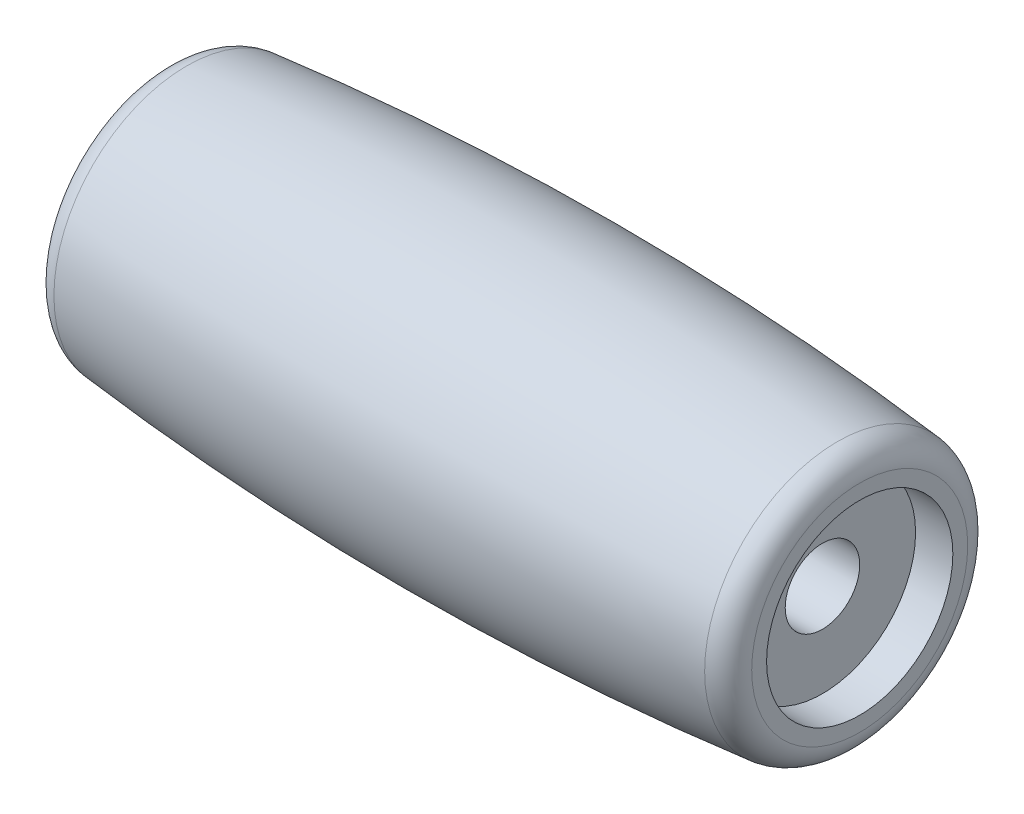
from build123d import *


with BuildPart() as part:
    # Sketch1 → Revolve1 (revolve)
    with BuildSketch(Plane.XY, mode=Mode.PRIVATE) as revolve1_sk:
        with BuildLine():
            ThreePointArc((-13.099967959, 5.343567322), (0, 6), (13.099967959, 5.343567322))
            ThreePointArc((13.099967959, 5.343567322), (13.741609048, 5.019408999), (14, 4.348576665))
            Line((14, 4.348576665), (14, 3.75))
            Line((14, 3.75), (12.5, 3.75))
            Line((12.5, 3.75), (12.5, 1.5))
            Line((12.5, 1.5), (-12.5, 1.5))
            Line((-12.5, 1.5), (-12.5, 3.75))
            Line((-12.5, 3.75), (-14, 3.75))
            Line((-14, 3.75), (-14, 4.348576665))
            ThreePointArc((-14, 4.348576665), (-13.741609048, 5.019408999), (-13.099967959, 5.343567322))
        make_face()
    revolve(revolve1_sk.sketch.rotate(Axis((-14, 0, 0), (1, 0, 0)), 90), axis=Axis((-14, 0, 0), (1, 0, 0)))


solid = part.part
